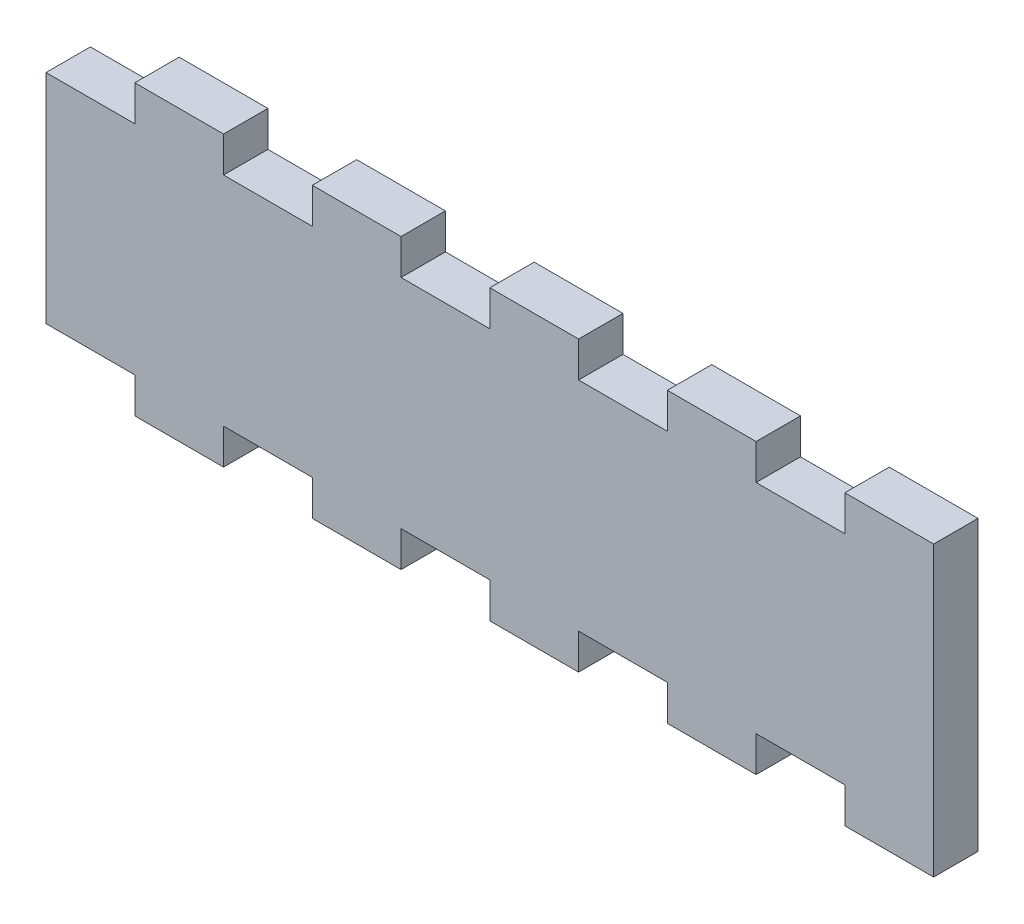
from build123d import *

# Parameters (mm, degrees)
SKETCH1_W           = 200
SKETCH1_H           = 65
BOSS_EXTRUDE1_DEPTH = 10
SKETCH2_W           = 20
SKETCH2_H           = 8
CUT_EXTRUDE1_DEPTH  = 121.448603896


with BuildPart() as part:
    # Sketch1 → Boss-Extrude1 (new body)
    with BuildSketch(Plane.XY):
        with Locations((-6.539833532, 22.791319857)):
            Rectangle(SKETCH1_W, SKETCH1_H)
    extrude(amount=BOSS_EXTRUDE1_DEPTH)

    # Sketch2 → Cut-Extrude1 (cut, through all)
    with BuildSketch(Plane.XY.offset(10)):
        with Locations((-56.539833532, 51.291319857)):
            Rectangle(SKETCH2_W, SKETCH2_H)
        with Locations((-96.539833532, 51.291319857)):
            Rectangle(SKETCH2_W, SKETCH2_H)
        with Locations((-96.539833532, -5.708680143)):
            Rectangle(SKETCH2_W, SKETCH2_H)
        with Locations((-56.539833532, -5.708680143)):
            Rectangle(SKETCH2_W, SKETCH2_H)
        with Locations((-16.539833532, 51.291319857)):
            Rectangle(SKETCH2_W, SKETCH2_H)
        with Locations((-16.539833532, -5.708680143)):
            Rectangle(SKETCH2_W, SKETCH2_H)
        with Locations((23.460166468, 51.291319857)):
            Rectangle(SKETCH2_W, SKETCH2_H)
        with Locations((23.460166468, -5.708680143)):
            Rectangle(SKETCH2_W, SKETCH2_H)
        with Locations((63.460166468, 51.291319857)):
            Rectangle(SKETCH2_W, SKETCH2_H)
        with Locations((63.460166468, -5.708680143)):
            Rectangle(SKETCH2_W, SKETCH2_H)
    extrude(amount=-CUT_EXTRUDE1_DEPTH, mode=Mode.SUBTRACT)


solid = part.part
